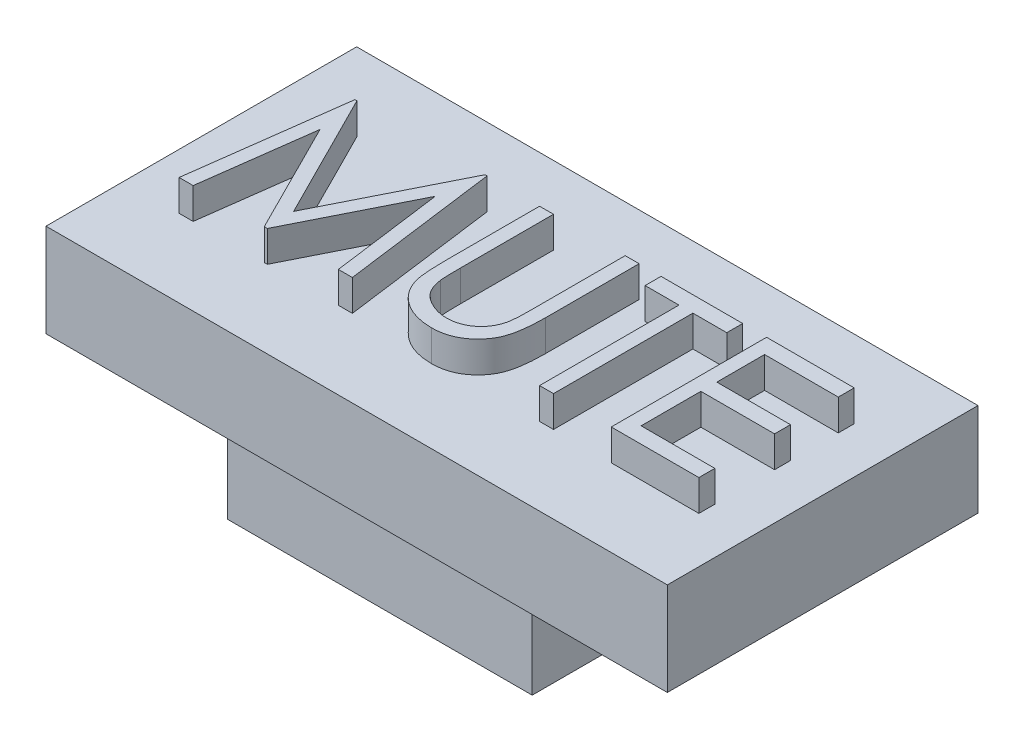
from build123d import *

# Parameters (mm, degrees)
SKETCH1_W           = 20
SKETCH1_H           = 10
BOSS_EXTRUDE1_DEPTH = 3
SKETCH2_W           = 9.8
SKETCH2_H           = 8.5
SKETCH2_W_2         = 5.8
SKETCH2_H_2         = 4.5
BOSS_EXTRUDE2_DEPTH = 3
BOSS_EXTRUDE3_DEPTH = 1


with BuildPart() as part:
    # Sketch1 → Boss-Extrude1 (new body)
    with BuildSketch(Plane(origin=(0, 0, 0), x_dir=(1, 0, 0), z_dir=(0, 1, 0))):
        Rectangle(SKETCH1_W, SKETCH1_H)
    extrude(amount=BOSS_EXTRUDE1_DEPTH)

    # Sketch2 → Boss-Extrude2 (add)
    with BuildSketch(Plane.XZ):
        Rectangle(SKETCH2_W, SKETCH2_H)
        Rectangle(SKETCH2_W_2, SKETCH2_H_2, mode=Mode.SUBTRACT)
    extrude(amount=BOSS_EXTRUDE2_DEPTH)

    # Sketch3 → Boss-Extrude3 (add)
    with BuildSketch(Plane(origin=(0, 3, 0), x_dir=(1, 0, 0), z_dir=(0, 1, 0))):
        Polygon((-8.215384615, -2.5), (-7.555328526, 2.5), (-7.491225962, 2.5), (-5.426923077, -1.602564103), (-3.367628205, 2.5), (-3.302524038, 2.5), (-2.638461538, -2.5), (-3.089182692, -2.5), (-3.567948718, 1.09775641), (-5.372836538, -2.5), (-5.473998397, -2.5), (-7.285897436, 1.105769231), (-7.763661859, -2.5), align=None)
        with BuildLine():
            Line((-1.612820513, 2.5), (-1.164102564, 2.5))
            Line((-1.164102564, 2.5), (-1.164102564, -0.495793269))
            add(Edge.make_bspline(
                [(-1.164102564, -0.495793269), (-1.164169341, -0.53819432), (-1.164296062, -0.618657622), (-1.163449614, -0.733183765), (-1.161079088, -0.835001564), (-1.159584574, -0.924503489), (-1.156259812, -1.001278843), (-1.153548316, -1.065743572), (-1.150061807, -1.117592433), (-1.145871639, -1.147850899), (-1.144070513, -1.160857372)],
                knots=[0, 0, 0, 0, 1.528628734, 2.90083645, 4.128790002, 5.200304208, 6.127813768, 6.898992206, 7.526736466, 8, 8, 8, 8], degree=3))
            add(Edge.make_bspline(
                [(-1.144070513, -1.160857372), (-1.136674143, -1.207781319), (-1.122298163, -1.298985218), (-1.08566048, -1.428854192), (-1.034492622, -1.545899133), (-0.973859703, -1.653772406), (-0.893955973, -1.749471491), (-0.798236637, -1.837630995), (-0.682268396, -1.914733574), (-0.553324674, -1.985234733), (-0.414345763, -2.041899137), (-0.272329668, -2.0847468), (-0.129411126, -2.110859514), (-0.033730891, -2.113883141), (0.013782051, -2.115384615)],
                knots=[0, 0, 0, 0, 1.035780045, 2.013197591, 2.933192213, 3.817615948, 4.702609284, 5.640816605, 6.646850145, 7.73207398, 8.84249596, 9.914020372, 10.964143139, 12, 12, 12, 12], degree=3))
            add(Edge.make_bspline(
                [(0.013782051, -2.115384615), (0.054573109, -2.113850544), (0.135919626, -2.11079126), (0.256785956, -2.091846359), (0.374500396, -2.057702694), (0.489644225, -2.013645896), (0.597574203, -1.955435051), (0.698350548, -1.888190995), (0.788299026, -1.809318315), (0.87038188, -1.722032109), (0.94186036, -1.62354668), (1.003819133, -1.516006483), (1.054570461, -1.39779313), (1.07963264, -1.314715384), (1.092508013, -1.272035256)],
                knots=[0, 0, 0, 0, 0.994687771, 1.983630487, 2.973142513, 3.978332533, 4.983357753, 5.956394766, 6.925816176, 7.893390482, 8.871859704, 9.88551698, 10.913711441, 12, 12, 12, 12], degree=3))
            add(Edge.make_bspline(
                [(1.092508013, -1.272035256), (1.096793906, -1.254394436), (1.106344604, -1.215083579), (1.115268954, -1.148624592), (1.12456399, -1.070211215), (1.131013376, -0.979280054), (1.137300833, -0.876135807), (1.141062366, -0.760241154), (1.142800984, -0.632016924), (1.143319099, -0.542535264), (1.143589744, -0.495793269)],
                knots=[0, 0, 0, 0, 0.558680831, 1.244966039, 2.062412453, 2.990489873, 4.051219941, 5.244515665, 6.560634259, 8, 8, 8, 8], degree=3))
            Line((1.143589744, -0.495793269), (1.143589744, 2.5))
            Line((1.143589744, 2.5), (1.592307692, 2.5))
            Line((1.592307692, 2.5), (1.592307692, -0.519831731))
            add(Edge.make_bspline(
                [(1.592307692, -0.519831731), (1.591944663, -0.574257986), (1.59123619, -0.680474133), (1.585092509, -0.836118932), (1.575296795, -0.983766048), (1.561456669, -1.123435329), (1.543118093, -1.254626985), (1.522724921, -1.37849094), (1.49675416, -1.494138072), (1.466420729, -1.602470097), (1.431744232, -1.705592259), (1.386828306, -1.803461709), (1.336221878, -1.899053708), (1.276200945, -1.990922435), (1.208756112, -2.079474654), (1.132396569, -2.164173332), (1.049647767, -2.24637197), (0.959134111, -2.323962064), (0.862347646, -2.395117317), (0.759576278, -2.457685562), (0.651609464, -2.510576444), (0.538727855, -2.554113479), (0.42088328, -2.58684862), (0.298072766, -2.6112417), (0.170016775, -2.625102125), (0.082924409, -2.627162025), (0.038822115, -2.628205128)],
                knots=[0, 0, 0, 0, 1.316592851, 2.569410997, 3.76748051, 4.895814652, 5.963796859, 6.97159953, 7.931736103, 8.829262218, 9.692595152, 10.560224239, 11.431080259, 12.30701507, 13.211635791, 14.121146779, 15.063487852, 16.031507147, 17.00238618, 17.966455255, 18.938106653, 19.907068911, 20.888905087, 21.893141452, 22.933117798, 24, 24, 24, 24], degree=3))
            add(Edge.make_bspline(
                [(0.038822115, -2.628205128), (-0.009276603, -2.627084035), (-0.103646115, -2.624884454), (-0.242700497, -2.612280525), (-0.376006492, -2.588539962), (-0.50497203, -2.558311471), (-0.627841312, -2.516620418), (-0.746260518, -2.467908811), (-0.858201491, -2.408084153), (-0.965480247, -2.341522163), (-1.065229898, -2.266629823), (-1.156797617, -2.185001003), (-1.240334575, -2.097943321), (-1.314432713, -2.004514227), (-1.380319691, -1.90544036), (-1.437077138, -1.800441446), (-1.485810344, -1.689558137), (-1.510962583, -1.612482137), (-1.523677885, -1.573517628)],
                knots=[0, 0, 0, 0, 1.13879206, 2.234305948, 3.301075583, 4.341971843, 5.366689343, 6.369221514, 7.369726634, 8.367512178, 9.355451585, 10.318319045, 11.268648973, 12.207971039, 13.137398894, 14.081662264, 15.030215811, 16, 16, 16, 16], degree=3))
            add(Edge.make_bspline(
                [(-1.523677885, -1.573517628), (-1.531073825, -1.546899665), (-1.547115784, -1.489164709), (-1.564294781, -1.393612583), (-1.578736326, -1.283591272), (-1.592315695, -1.159093245), (-1.600328492, -1.020022007), (-1.607353404, -0.866437842), (-1.612870002, -0.698155039), (-1.61283747, -0.580934303), (-1.612820513, -0.519831731)],
                knots=[0, 0, 0, 0, 0.625038921, 1.35572334, 2.194682327, 3.136881307, 4.189498639, 5.346923369, 6.617055217, 8, 8, 8, 8], degree=3))
            Line((-1.612820513, -0.519831731), (-1.612820513, 2.5))
        make_face()
        Polygon((2.297435897, 1.987179487), (2.297435897, 2.5), (4.925641026, 2.5), (4.925641026, 1.987179487), (3.835897436, 1.987179487), (3.835897436, -2.5), (3.387179487, -2.5), (3.387179487, 1.987179487), align=None)
        Polygon((5.694871795, 2.5), (8.515384615, 2.5), (8.515384615, 1.987179487), (6.143589744, 1.987179487), (6.143589744, 0.448717949), (8.515384615, 0.448717949), (8.515384615, -0.064102564), (6.143589744, -0.064102564), (6.143589744, -1.987179487), (8.515384615, -1.987179487), (8.515384615, -2.5), (5.694871795, -2.5), align=None)
    extrude(amount=BOSS_EXTRUDE3_DEPTH)


solid = part.part
